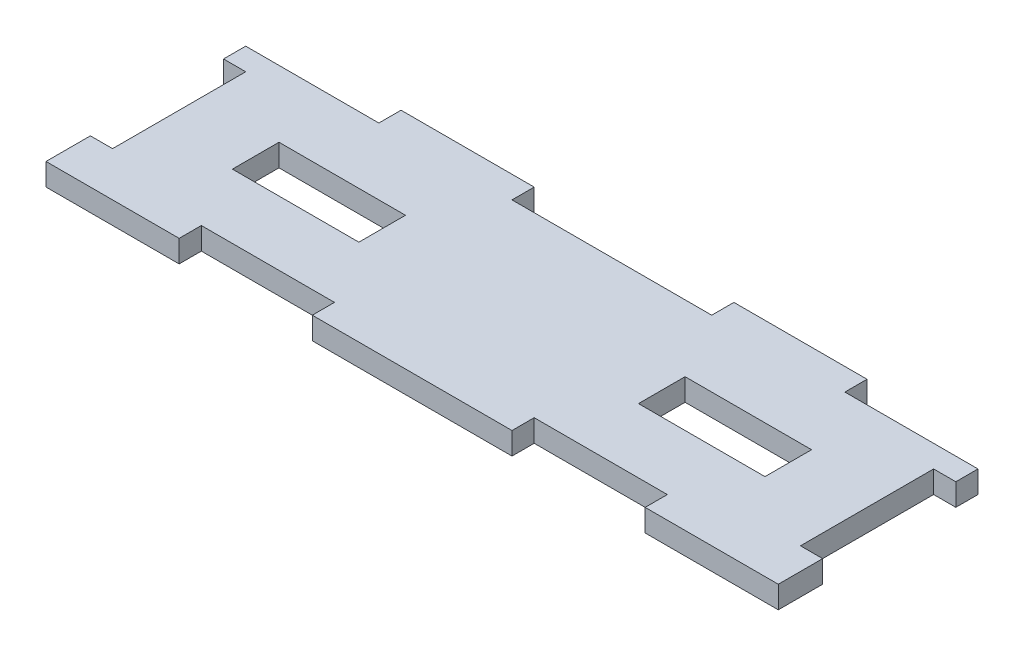
from build123d import *

# Parameters (mm, degrees)
SKETCH1_W           = 28.5
SKETCH1_H           = 10.5
BOSS_EXTRUDE1_DEPTH = 5


with BuildPart() as part:
    # Sketch1 → Boss-Extrude1 (new body)
    with BuildSketch(Plane(origin=(0, 0, 0), x_dir=(1, 0, 0), z_dir=(0, 1, 0))):
        Polygon((0, 40), (0, 45), (30, 45), (30, 50), (60, 50), (60, 45), (105, 45), (105, 50), (135, 50), (135, 45), (165, 45), (165, 40), (160, 40), (160, 10), (165, 10), (165, 0), (135, 0), (135, 5), (105, 5), (105, 0), (60, 0), (60, 5), (30, 5), (30, 0), (0, 0), (0, 10), (5, 10), (5, 40), align=None)
        with Locations((36.75, 24.75)):
            Rectangle(SKETCH1_W, SKETCH1_H, mode=Mode.SUBTRACT)
        with Locations((128.25, 24.75)):
            Rectangle(SKETCH1_W, SKETCH1_H, mode=Mode.SUBTRACT)
    extrude(amount=BOSS_EXTRUDE1_DEPTH)


solid = part.part
